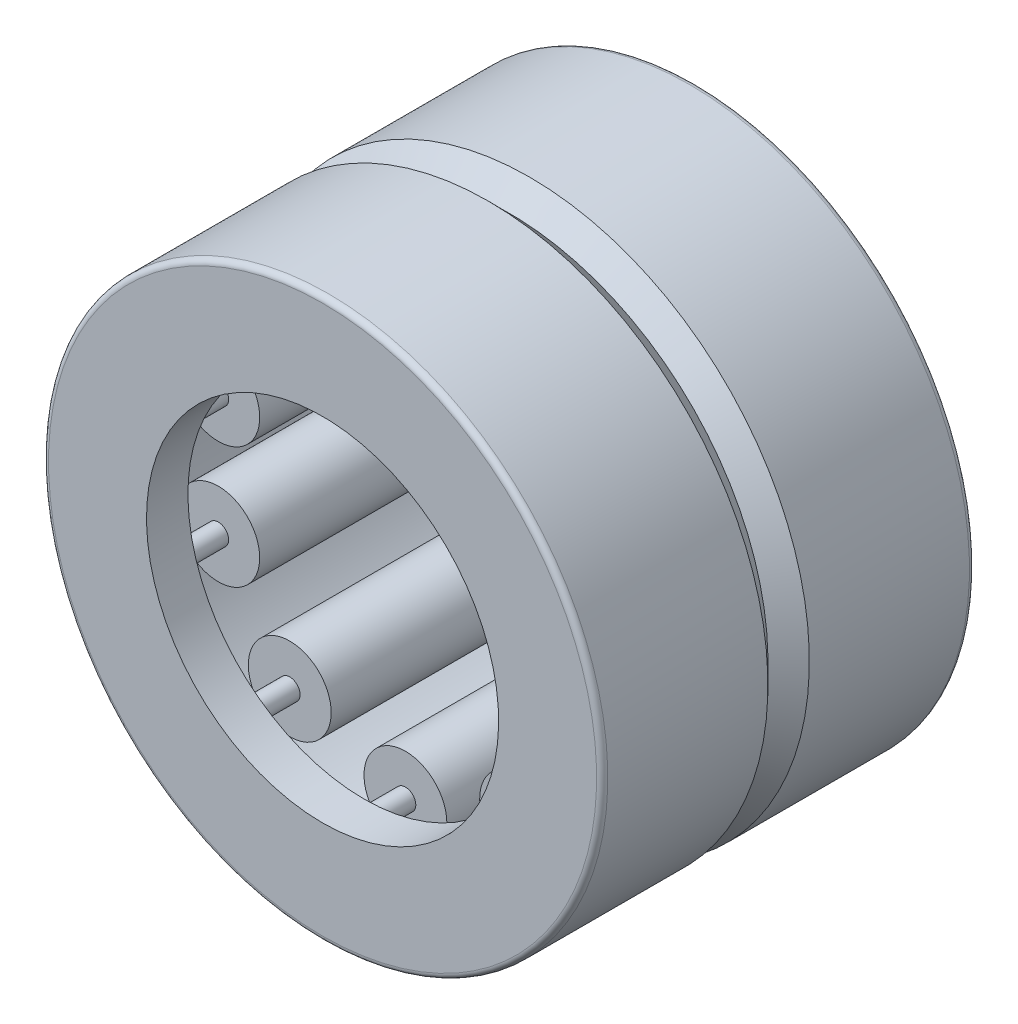
from build123d import *

# Parameters (mm, degrees)
SKETCH2_W         = 10.583333334
SKETCH2_H         = 1.5875
SKETCH3_W         = 14.816666666
SKETCH3_H         = 0.529166666
CIRPATTERN1_COUNT = 10
FILLET1_R         = 0.28575


with BuildPart() as part:
    # Sketch1 → Revolve1 (revolve)
    with BuildSketch(Plane(origin=(0, 0, 0), x_dir=(0, 0, -1), z_dir=(1, 0, 0)), mode=Mode.PRIVATE) as revolve1_sk:
        Polygon((-9.525, 14.2875), (9.525, 14.2875), (9.525, 8.995833333), (7.408333333, 8.995833333), (7.408333333, 12.170833333), (-7.408333333, 12.170833333), (-7.408333333, 8.995833333), (-9.525, 8.995833333), align=None)
    revolve(revolve1_sk.sketch.rotate(Axis((0, 0, 9.525), (0, 0, -1)), 180), axis=Axis((0, 0, 9.525), (0, 0, -1)))

    # Fillet1
    fillet1_edges = [part.edges().sort_by_distance(p)[0] for p in [
        (0, 14.2875, 9.525),
        (0, 14.2875, -9.525),
    ]]
    fillet(fillet1_edges, radius=FILLET1_R)

    # Sketch4 → Cut-Revolve1 (revolve, cut)
    with BuildSketch(Plane(origin=(0, 0, 0), x_dir=(0, 0, -1), z_dir=(1, 0, 0)), mode=Mode.PRIVATE) as cut_revolve1_sk:
        Polygon((-1.058333333, 14.2875), (0, 13.229166667), (1.058333333, 14.2875), align=None)
    revolve(cut_revolve1_sk.sketch.rotate(Axis((0, 0, 9.525), (0, 0, -1)), 180), axis=Axis((0, 0, 9.525), (0, 0, -1)), mode=Mode.SUBTRACT)


with BuildPart() as body_2:
    # Sketch2 → Revolve2 (revolve)
    with BuildSketch(Plane(origin=(0, 0, 0), x_dir=(0, 0, -1), z_dir=(1, 0, 0)), mode=Mode.PRIVATE) as revolve2_sk:
        with Locations((0, 11.377083333)):
            Rectangle(SKETCH2_W, SKETCH2_H)
    revolve(revolve2_sk.sketch.rotate(Axis((0, 10.054166667, 5.291666667), (0, 0, -1)), 180), axis=Axis((0, 10.054166667, 5.291666667), (0, 0, -1)))


with BuildPart() as body_3:
    # Sketch3 → Revolve3 (revolve)
    with BuildSketch(Plane(origin=(0, 0, 0), x_dir=(0, 0, -1), z_dir=(1, 0, 0)), mode=Mode.PRIVATE) as revolve3_sk:
        with Locations((0, 10.31875)):
            Rectangle(SKETCH3_W, SKETCH3_H)
    revolve(revolve3_sk.sketch.rotate(Axis((0, 10.054166667, 7.408333333), (0, 0, -1)), 90), axis=Axis((0, 10.054166667, 7.408333333), (0, 0, -1)))


with BuildPart() as cirpattern1_1:
    # CirPattern1: pattern copy
    add(body_3.part.rotate(Axis((0, 0, 0), (0, 0, 1)), 1 * 360 / CIRPATTERN1_COUNT))


with BuildPart() as cirpattern1_2:
    # CirPattern1: pattern copy
    add(body_3.part.rotate(Axis((0, 0, 0), (0, 0, 1)), 2 * 360 / CIRPATTERN1_COUNT))


with BuildPart() as cirpattern1_3:
    # CirPattern1: pattern copy
    add(body_3.part.rotate(Axis((0, 0, 0), (0, 0, 1)), 3 * 360 / CIRPATTERN1_COUNT))


with BuildPart() as cirpattern1_4:
    # CirPattern1: pattern copy
    add(body_3.part.rotate(Axis((0, 0, 0), (0, 0, 1)), 4 * 360 / CIRPATTERN1_COUNT))


with BuildPart() as cirpattern1_5:
    # CirPattern1: pattern copy
    add(body_3.part.rotate(Axis((0, 0, 0), (0, 0, 1)), 5 * 360 / CIRPATTERN1_COUNT))


with BuildPart() as cirpattern1_6:
    # CirPattern1: pattern copy
    add(body_3.part.rotate(Axis((0, 0, 0), (0, 0, 1)), 6 * 360 / CIRPATTERN1_COUNT))


with BuildPart() as cirpattern1_7:
    # CirPattern1: pattern copy
    add(body_3.part.rotate(Axis((0, 0, 0), (0, 0, 1)), 7 * 360 / CIRPATTERN1_COUNT))


with BuildPart() as cirpattern1_8:
    # CirPattern1: pattern copy
    add(body_3.part.rotate(Axis((0, 0, 0), (0, 0, 1)), 8 * 360 / CIRPATTERN1_COUNT))


with BuildPart() as cirpattern1_9:
    # CirPattern1: pattern copy
    add(body_3.part.rotate(Axis((0, 0, 0), (0, 0, 1)), 9 * 360 / CIRPATTERN1_COUNT))


with BuildPart() as cirpattern1_10:
    # CirPattern1: pattern copy
    add(body_2.part.rotate(Axis((0, 0, 0), (0, 0, 1)), 1 * 360 / CIRPATTERN1_COUNT))


with BuildPart() as cirpattern1_11:
    # CirPattern1: pattern copy
    add(body_2.part.rotate(Axis((0, 0, 0), (0, 0, 1)), 2 * 360 / CIRPATTERN1_COUNT))


with BuildPart() as cirpattern1_12:
    # CirPattern1: pattern copy
    add(body_2.part.rotate(Axis((0, 0, 0), (0, 0, 1)), 3 * 360 / CIRPATTERN1_COUNT))


with BuildPart() as cirpattern1_13:
    # CirPattern1: pattern copy
    add(body_2.part.rotate(Axis((0, 0, 0), (0, 0, 1)), 4 * 360 / CIRPATTERN1_COUNT))


with BuildPart() as cirpattern1_14:
    # CirPattern1: pattern copy
    add(body_2.part.rotate(Axis((0, 0, 0), (0, 0, 1)), 5 * 360 / CIRPATTERN1_COUNT))


with BuildPart() as cirpattern1_15:
    # CirPattern1: pattern copy
    add(body_2.part.rotate(Axis((0, 0, 0), (0, 0, 1)), 6 * 360 / CIRPATTERN1_COUNT))


with BuildPart() as cirpattern1_16:
    # CirPattern1: pattern copy
    add(body_2.part.rotate(Axis((0, 0, 0), (0, 0, 1)), 7 * 360 / CIRPATTERN1_COUNT))


with BuildPart() as cirpattern1_17:
    # CirPattern1: pattern copy
    add(body_2.part.rotate(Axis((0, 0, 0), (0, 0, 1)), 8 * 360 / CIRPATTERN1_COUNT))


with BuildPart() as cirpattern1_18:
    # CirPattern1: pattern copy
    add(body_2.part.rotate(Axis((0, 0, 0), (0, 0, 1)), 9 * 360 / CIRPATTERN1_COUNT))


solid = Compound([part.part, body_2.part, body_3.part, cirpattern1_1.part, cirpattern1_2.part, cirpattern1_3.part, cirpattern1_4.part, cirpattern1_5.part, cirpattern1_6.part, cirpattern1_7.part, cirpattern1_8.part, cirpattern1_9.part, cirpattern1_10.part, cirpattern1_11.part, cirpattern1_12.part, cirpattern1_13.part, cirpattern1_14.part, cirpattern1_15.part, cirpattern1_16.part, cirpattern1_17.part, cirpattern1_18.part])
